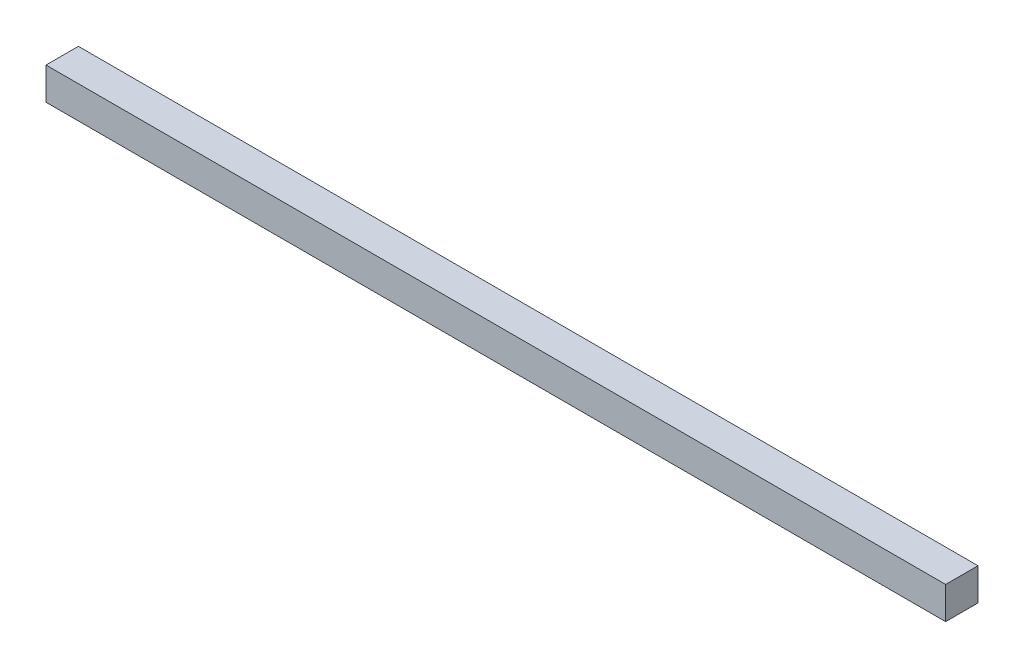
from build123d import *

# Parameters (mm, degrees)
EXTRUDE_1_DEPTH      = 240
EXTRUDE_1_DEPTH_BACK = 43.5
SKETCH_1_W           = 10.201404516
SKETCH_1_H           = 10.162826856


with BuildPart() as part:
    # 草图1 → 凸台-拉伸1 (new, two sides: drawn at the far end of the back side and taken through both)
    with BuildSketch(Plane(origin=(0, 0, 0), x_dir=(0, 0, -1), z_dir=(1, 0, 0)).offset(-EXTRUDE_1_DEPTH_BACK)):
        Rectangle(SKETCH_1_W, SKETCH_1_H)
    extrude(amount=EXTRUDE_1_DEPTH + EXTRUDE_1_DEPTH_BACK)


solid = part.part
